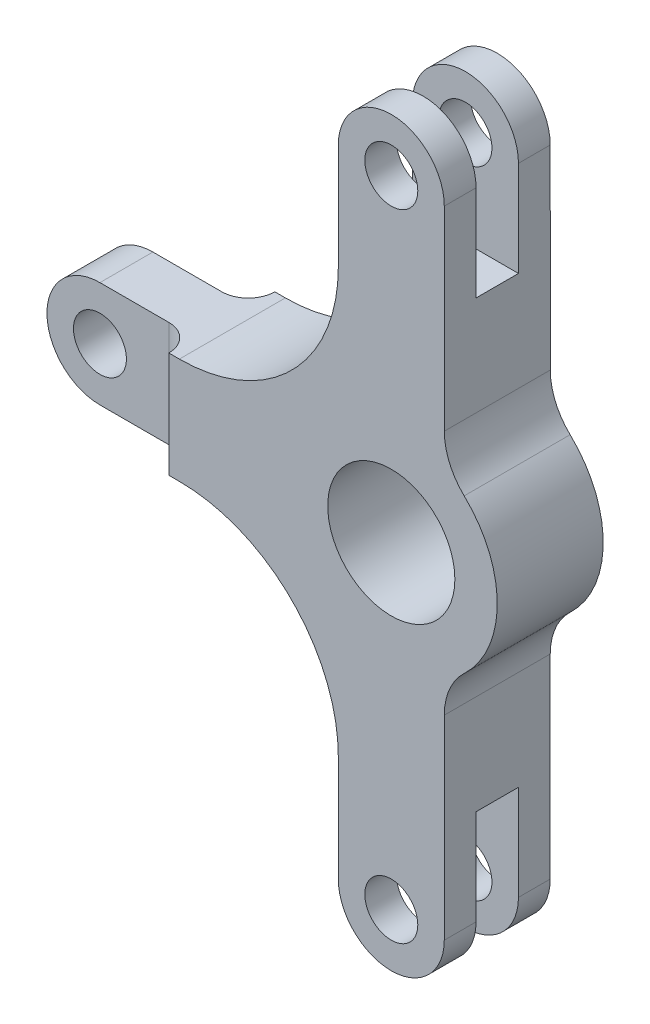
from build123d import *

# Parameters (mm, degrees)
SKETCH1_R               = 63.5
SKETCH1_R_2             = 152.4
BOSS_EXTRUDE1_DEPTH     = 127
CUT_EXTRUDE1_DEPTH      = 1264.634045125
CUT_EXTRUDE1_DEPTH_BACK = 1264.634045125
SKETCH2_W               = 101.6
SKETCH2_H               = 355.6
CUT_EXTRUDE2_DEPTH      = 254


with BuildPart() as part:
    # Sketch1 → Boss-Extrude1 (new, symmetric)
    with BuildSketch(Plane.XY):
        with BuildLine():
            Line((127, -294.794488402), (127, -762))
            ThreePointArc((127, -762), (0, -889), (-127, -762))
            Line((-127, -762), (-127, -508))
            ThreePointArc((-127, -508), (-238.592316368, -238.592316368), (-508, -127))
            Line((-508, -127), (-762, -127))
            ThreePointArc((-762, -127), (-889, 0), (-762, 127))
            Line((-762, 127), (-508, 127))
            ThreePointArc((-508, 127), (-238.592316368, 238.592316368), (-127, 508))
            Line((-127, 508), (-127, 762))
            ThreePointArc((-127, 762), (0, 889), (127, 762))
            Line((127, 762), (127.177644281, 294.893747175))
            ThreePointArc((127.177644281, 294.893747175), (139.582882613, 234.726570772), (174.736020462, 184.345662149))
            ThreePointArc((174.736020462, 184.345662149), (253.999988445, -0.076613885), (174.624780504, -184.451039666))
            ThreePointArc((174.624780504, -184.451039666), (139.476090274, -234.729960661), (127, -294.794488402))
        make_face()
        with Locations((0, 762)):
            Circle(SKETCH1_R, mode=Mode.SUBTRACT)
        with Locations((0, -762)):
            Circle(SKETCH1_R, mode=Mode.SUBTRACT)
        with Locations((-762, 0)):
            Circle(SKETCH1_R, mode=Mode.SUBTRACT)
        Circle(SKETCH1_R_2, mode=Mode.SUBTRACT)
    extrude(amount=BOSS_EXTRUDE1_DEPTH, both=True)

    # Sketch2 → Cut-Extrude1 (cut, two sides: drawn at the far end of the back side and taken through both)
    with BuildSketch(Plane(origin=(0, 0, 0), x_dir=(0, 0, -1), z_dir=(1, 0, 0)).offset(-CUT_EXTRUDE1_DEPTH_BACK)):
        Polygon((-50.8, 889), (50.8, 889), (50.8, 533.4), (0, 533.4), (-50.8, 533.4), align=None)
        with Locations((0, -711.2)):
            Rectangle(SKETCH2_W, SKETCH2_H)
    extrude(amount=CUT_EXTRUDE1_DEPTH + CUT_EXTRUDE1_DEPTH_BACK, mode=Mode.SUBTRACT)

    # Sketch3 → Cut-Extrude2 (cut)
    with BuildSketch(Plane(origin=(0, 127, 0), x_dir=(1, 0, 0), z_dir=(0, 1, 0))):
        with BuildLine():
            Line((-762, 127), (-762, 63.5))
            Line((-762, 63.5), (-596.9, 63.5))
            ThreePointArc((-596.9, 63.5), (-551.998719395, 82.098719395), (-533.4, 127))
            Line((-533.4, 127), (-762, 127))
        make_face()
        Polygon((-889, 63.5), (-762, 63.5), (-762, 127), (-533.4, 127), (-533.4, 247.034120233), (-889, 247.034120233), align=None)
        Polygon((-762, -127), (-762, -63.5), (-889, -63.5), (-889, -178.364595134), (-533.4, -178.364595134), (-533.4, -127), align=None)
        with BuildLine():
            ThreePointArc((-533.4, -127), (-551.998719395, -82.098719395), (-596.9, -63.5))
            Line((-596.9, -63.5), (-762, -63.5))
            Line((-762, -63.5), (-762, -127))
            Line((-762, -127), (-533.4, -127))
        make_face()
    extrude(amount=-CUT_EXTRUDE2_DEPTH, mode=Mode.SUBTRACT)


solid = part.part
